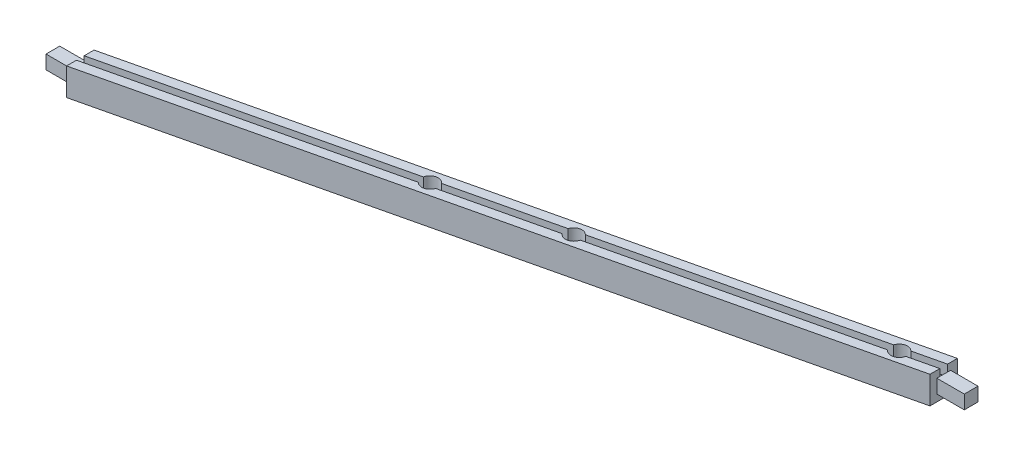
from build123d import *

# Parameters (mm, degrees)
BOSS_EXTRUDE1_DEPTH = 5
SKETCH2_W           = 2.5
SKETCH2_H           = 2.5
BOSS_EXTRUDE2_DEPTH = 5
SKETCH3_W           = 2.5
SKETCH3_H           = 2.5
BOSS_EXTRUDE3_DEPTH = 5
SKETCH6_R           = 1.5
CUT_EXTRUDE1_DEPTH  = 5
CUT_EXTRUDE3_DEPTH  = 2


with BuildPart() as part:
    # Sketch1 → Boss-Extrude1 (new body)
    with BuildSketch(Plane(origin=(0, 0, 0), x_dir=(1, 0, 0), z_dir=(0, 1, 0))):
        Polygon((0, 5), (0, 0), (127.3, 30), (127.3, 35), align=None)
    extrude(amount=BOSS_EXTRUDE1_DEPTH)

    # Sketch2 → Boss-Extrude2 (add)
    with BuildSketch(Plane(origin=(127.3, 0, 0), x_dir=(0, 0, -1), z_dir=(1, 0, 0))):
        with Locations((32.5, 2.5)):
            Rectangle(SKETCH2_W, SKETCH2_H)
    extrude(amount=BOSS_EXTRUDE2_DEPTH)

    # Sketch3 → Boss-Extrude3 (add)
    with BuildSketch(Plane.ZY):
        with Locations((-2.5, 2.5)):
            Rectangle(SKETCH3_W, SKETCH3_H)
    extrude(amount=BOSS_EXTRUDE3_DEPTH)

    # Sketch6 → Cut-Extrude1 (cut)
    with BuildSketch(Plane.XZ):
        with Locations(Location((51.5, -14.705168766, 0), (0, 0, 270))):
            Circle(SKETCH6_R)
        with Locations(Location((72.8, -19.587839875, 0), (0, 0, 270))):
            Circle(SKETCH6_R)
        with Locations(Location((120.8, -30.899701619, 0), (0, 0, 270))):
            Circle(SKETCH6_R)
    extrude(amount=-CUT_EXTRUDE1_DEPTH, mode=Mode.SUBTRACT)

    # Sketch10 → Cut-Extrude3 (cut)
    with BuildSketch(Plane(origin=(0, 5, 0), x_dir=(1, 0, 0), z_dir=(0, 1, 0))):
        Polygon((0, 3.202061361), (0, 1.797938639), (127.3, 31.797938639), (127.3, 33.202061361), align=None)
    extrude(amount=-CUT_EXTRUDE3_DEPTH, mode=Mode.SUBTRACT)


solid = part.part
